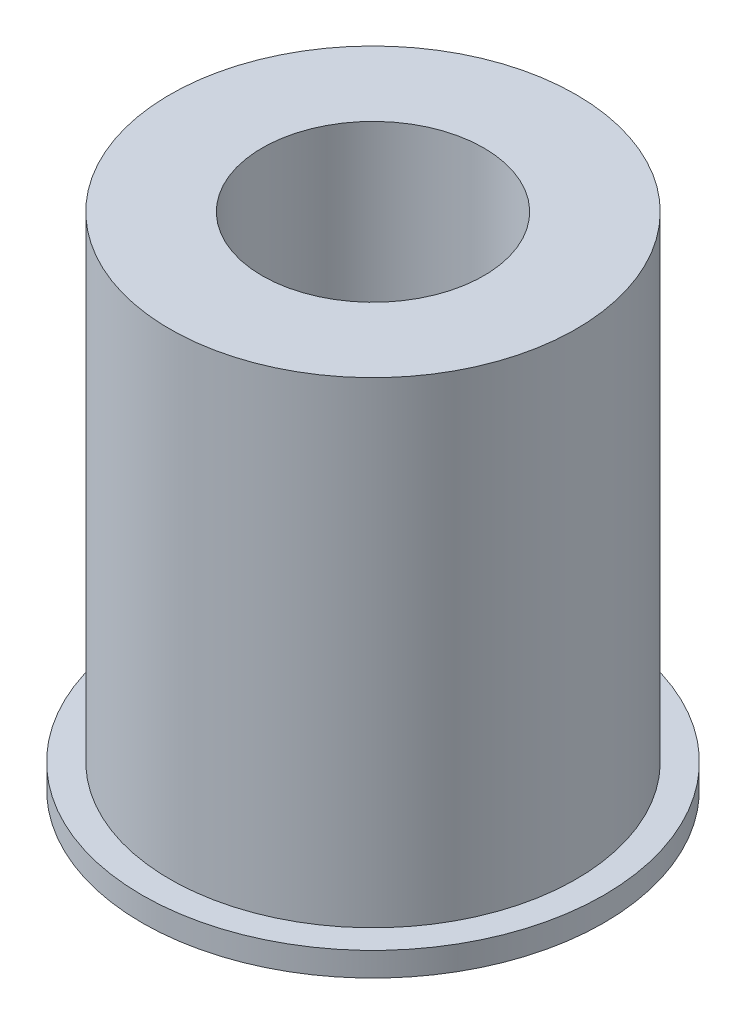
from build123d import *

# Parameters (mm, degrees)
SKETCH1_R           = 11
BOSS_EXTRUDE1_DEPTH = 27.1
SKETCH2_R           = 12.5
BOSS_EXTRUDE2_DEPTH = 1.3
SKETCH3_R           = 6
CUT_EXTRUDE1_DEPTH  = 29.3


with BuildPart() as part:
    # Sketch1 → Boss-Extrude1 (new body)
    with BuildSketch(Plane(origin=(0, 0, 0), x_dir=(1, 0, 0), z_dir=(0, 1, 0))):
        with Locations(Location((0, 0, 0), (0, 0, 90))):
            Circle(SKETCH1_R)
    extrude(amount=BOSS_EXTRUDE1_DEPTH)

    # Sketch2 → Boss-Extrude2 (add)
    with BuildSketch(Plane(origin=(0, 0, 0), x_dir=(1, 0, 0), z_dir=(0, 1, 0))):
        with Locations(Location((0, 0, 0), (0, 0, 270))):
            Circle(SKETCH2_R)
    extrude(amount=BOSS_EXTRUDE2_DEPTH)

    # Sketch3 → Cut-Extrude1 (cut)
    with BuildSketch(Plane(origin=(0, 0, 0), x_dir=(1, 0, 0), z_dir=(0, 1, 0))):
        with Locations(Location((0, 0, 0), (0, 0, 270))):
            Circle(SKETCH3_R)
    extrude(amount=CUT_EXTRUDE1_DEPTH, mode=Mode.SUBTRACT)


solid = part.part
